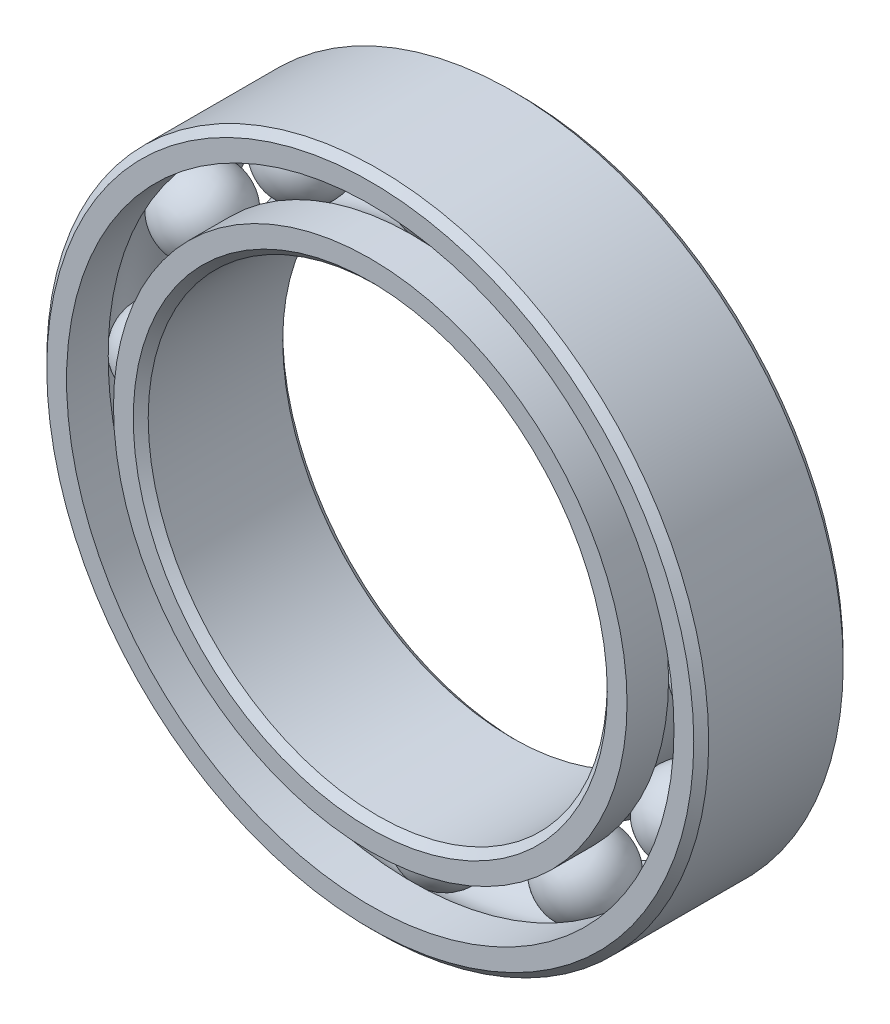
from build123d import *

# Parameters (mm, degrees)
CIRPATTERN1_COUNT = 12


with BuildPart() as part:
    # Sketch1 → Revolve1 (revolve)
    with BuildSketch(Plane(origin=(0, 0, 0), x_dir=(0, 0, -1), z_dir=(1, 0, 0))):
        with BuildLine():
            Line((3.15, 15.5), (-3.15, 15.5))
            Line((-3.15, 15.5), (-3.5, 15.15))
            Line((-3.5, 15.15), (-3.5, 14.223901099))
            Line((-3.5, 14.223901099), (-1.555555556, 14.223901099))
            ThreePointArc((-1.555555556, 14.223901099), (0, 15.029556828), (1.555555556, 14.223901099))
            Line((1.555555556, 14.223901099), (3.5, 14.223901099))
            Line((3.5, 14.223901099), (3.5, 15.15))
            Line((3.5, 15.15), (3.15, 15.5))
        make_face()
    revolve(axis=Axis((0, 0, 3.5), (0, 0, -1)))


with BuildPart() as body_2:
    # Sketch3 → Revolve3 (revolve)
    with BuildSketch(Plane(origin=(0, 0, 0), x_dir=(0, 0, -1), z_dir=(1, 0, 0))):
        with BuildLine():
            Line((-3.5, 12.026098901), (-1.555555556, 12.026098901))
            ThreePointArc((-1.555555556, 12.026098901), (0, 11.220443172), (1.555555556, 12.026098901))
            Line((1.555555556, 12.026098901), (3.5, 12.026098901))
            Line((3.5, 12.026098901), (3.5, 11.1))
            Line((3.5, 11.1), (3.15, 10.75))
            Line((3.15, 10.75), (-3.15, 10.75))
            Line((-3.15, 10.75), (-3.5, 11.1))
            Line((-3.5, 11.1), (-3.5, 12.026098901))
        make_face()
    revolve(axis=Axis((0, 0, 3.5), (0, 0, -1)))


with BuildPart() as body_3:
    # Sketch4 → Revolve4 (revolve)
    with BuildSketch(Plane(origin=(0, 0, 0), x_dir=(0, 0, -1), z_dir=(1, 0, 0))):
        with BuildLine():
            Line((-1.904556828, 13.125), (1.904556828, 13.125))
            ThreePointArc((1.904556828, 13.125), (0, 15.029556828), (-1.904556828, 13.125))
        make_face()
    revolve(axis=Axis((0, 13.125, 1.904556828), (0, 0, -1)))


with BuildPart() as cirpattern1_1:
    # CirPattern1: pattern copy
    add(body_3.part.rotate(Axis((0, 0, -3.5), (0, 0, 1)), 1 * 360 / CIRPATTERN1_COUNT))


with BuildPart() as cirpattern1_2:
    # CirPattern1: pattern copy
    add(body_3.part.rotate(Axis((0, 0, -3.5), (0, 0, 1)), 2 * 360 / CIRPATTERN1_COUNT))


with BuildPart() as cirpattern1_3:
    # CirPattern1: pattern copy
    add(body_3.part.rotate(Axis((0, 0, -3.5), (0, 0, 1)), 3 * 360 / CIRPATTERN1_COUNT))


with BuildPart() as cirpattern1_4:
    # CirPattern1: pattern copy
    add(body_3.part.rotate(Axis((0, 0, -3.5), (0, 0, 1)), 4 * 360 / CIRPATTERN1_COUNT))


with BuildPart() as cirpattern1_5:
    # CirPattern1: pattern copy
    add(body_3.part.rotate(Axis((0, 0, -3.5), (0, 0, 1)), 5 * 360 / CIRPATTERN1_COUNT))


with BuildPart() as cirpattern1_6:
    # CirPattern1: pattern copy
    add(body_3.part.rotate(Axis((0, 0, -3.5), (0, 0, 1)), 6 * 360 / CIRPATTERN1_COUNT))


with BuildPart() as cirpattern1_7:
    # CirPattern1: pattern copy
    add(body_3.part.rotate(Axis((0, 0, -3.5), (0, 0, 1)), 7 * 360 / CIRPATTERN1_COUNT))


with BuildPart() as cirpattern1_8:
    # CirPattern1: pattern copy
    add(body_3.part.rotate(Axis((0, 0, -3.5), (0, 0, 1)), 8 * 360 / CIRPATTERN1_COUNT))


with BuildPart() as cirpattern1_9:
    # CirPattern1: pattern copy
    add(body_3.part.rotate(Axis((0, 0, -3.5), (0, 0, 1)), 9 * 360 / CIRPATTERN1_COUNT))


with BuildPart() as cirpattern1_10:
    # CirPattern1: pattern copy
    add(body_3.part.rotate(Axis((0, 0, -3.5), (0, 0, 1)), 10 * 360 / CIRPATTERN1_COUNT))


with BuildPart() as cirpattern1_11:
    # CirPattern1: pattern copy
    add(body_3.part.rotate(Axis((0, 0, -3.5), (0, 0, 1)), 11 * 360 / CIRPATTERN1_COUNT))


solid = Compound([part.part, body_2.part, body_3.part, cirpattern1_1.part, cirpattern1_2.part, cirpattern1_3.part, cirpattern1_4.part, cirpattern1_5.part, cirpattern1_6.part, cirpattern1_7.part, cirpattern1_8.part, cirpattern1_9.part, cirpattern1_10.part, cirpattern1_11.part])
